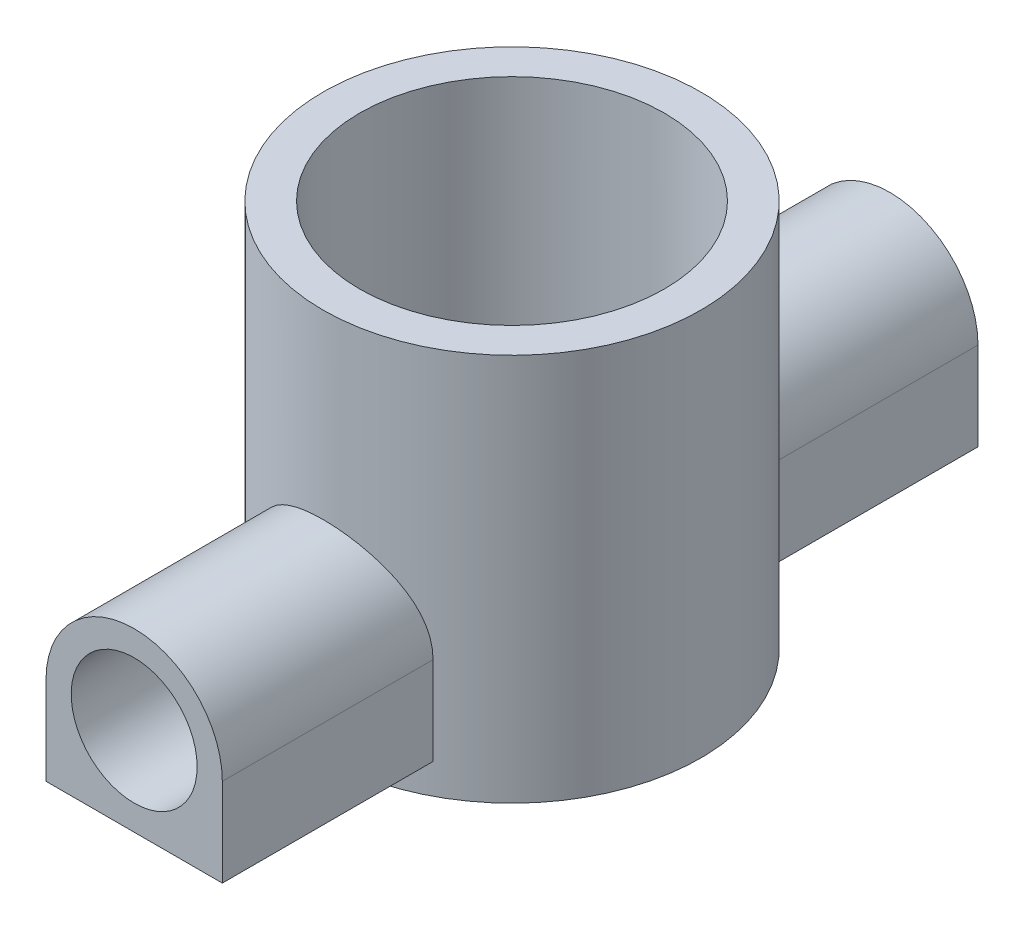
from build123d import *

# Parameters (mm, degrees)
SKETCH1_R             = 7.5
BASE_CYLINDER_DEPTH   = 15.4
LED_HOLDER_DEPTH      = 7.5
LED_HOLDER_DEPTH_BACK = 22.5
F_3DSKETCH2_R         = 3.5
SKETCH2_R             = 6.05
CUT_EXTRUDE1_DEPTH    = 14.2
CUT_EXTRUDE2_REACH    = 24.769
SKETCH3_R             = 1.75
SKETCH4_R             = 2.5
CUT_EXTRUDE3_DEPTH    = 35.545766898


with BuildPart() as part:
    # Sketch1 → base-cylinder (new body)
    with BuildSketch(Plane(origin=(0, 0, 0), x_dir=(1, 0, 0), z_dir=(0, 1, 0))):
        with Locations(Location((0, 0, 0), (0, 0, 90))):
            Circle(SKETCH1_R)
    extrude(amount=BASE_CYLINDER_DEPTH)

    # 3DSketch2 → led-holder (add, two sides: drawn at the far end of the back side and taken through both)
    with BuildSketch(Plane(origin=(-3.5, 4.7, 7.5), x_dir=(0.894427190999916, -0.44721359549995804, 0), z_dir=(0, 0, 1)).offset(-LED_HOLDER_DEPTH_BACK)):
        with Locations((3.130495168, 1.565247584)):
            Circle(F_3DSKETCH2_R)
        Polygon((0, 0), (6.260990337, 3.130495168), (7.826237921, 0), (1.565247584, -3.130495168), align=None)
    extrude(amount=LED_HOLDER_DEPTH + LED_HOLDER_DEPTH_BACK)

    # Sketch2 → Cut-Extrude1 (cut)
    with BuildSketch(Plane(origin=(0, 15.4, 0), x_dir=(1, 0, 0), z_dir=(0, 1, 0))):
        with Locations(Location((0, 0, 0), (0, 0, 270))):
            Circle(SKETCH2_R)
    extrude(amount=-CUT_EXTRUDE1_DEPTH, mode=Mode.SUBTRACT)

    # Sketch3 → Cut-Extrude2 (cut, up to next)
    with BuildSketch(Plane.XZ, mode=Mode.PRIVATE) as cut_extrude2_sk1:
        with Locations(Location((0, 0, 0), (0, 0, 270))):
            Circle(SKETCH3_R)
    cut_extrude2_tool1 = extrude(cut_extrude2_sk1.sketch, amount=-CUT_EXTRUDE2_REACH, mode=Mode.PRIVATE) & part.part
    add(cut_extrude2_tool1.solids().sort_by_distance((0, 0, 0))[0], mode=Mode.SUBTRACT)

    # Sketch4 → Cut-Extrude3 (cut, through all)
    with BuildSketch(Plane(origin=(0, 0, -15), x_dir=(-1, 0, 0), z_dir=(0, 0, -1))):
        with Locations((0, 4.7)):
            Circle(SKETCH4_R)
    extrude(amount=-CUT_EXTRUDE3_DEPTH, mode=Mode.SUBTRACT)


solid = part.part
